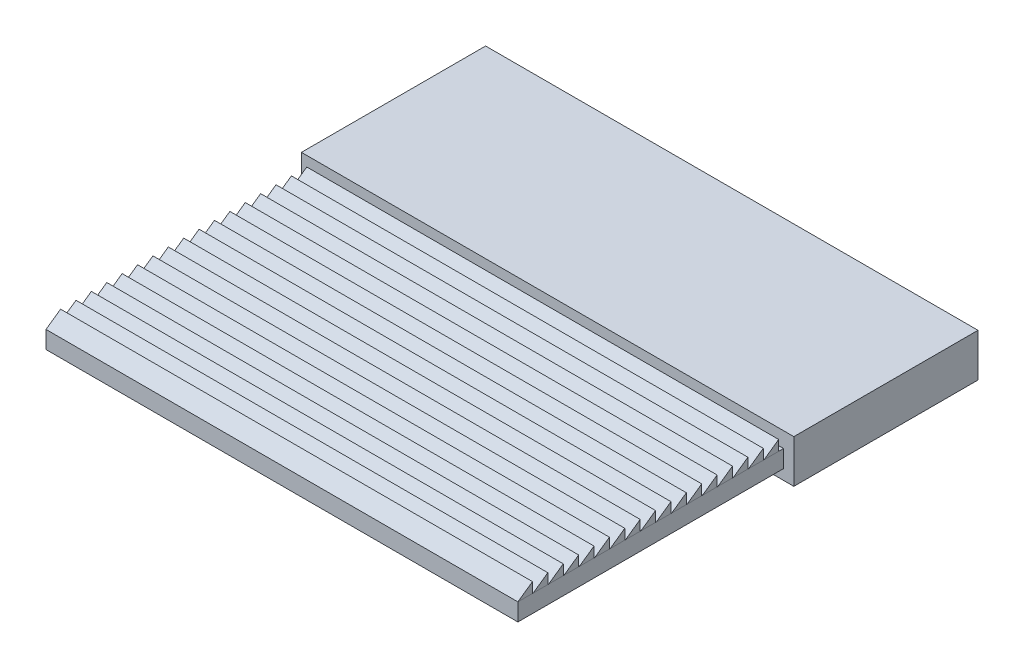
from build123d import *

# Parameters (mm, degrees)
SKETCH1_W              = 240
SKETCH1_H              = 351.15
BOSS_EXTRUDE3_DEPTH    = 21
SKETCH5_W              = 248.975913499
SKETCH5_H              = 113.170869772
CUT_EXTRUDE2_DEPTH     = 513
SKETCH4_W              = 240
SKETCH4_H              = 129.5
CUT_EXTRUDE3_DEPTH     = 7.5
SKETCH6_W              = 240
SKETCH6_H              = 129.5
CUT_EXTRUDE4_DEPTH     = 5
SKETCH8_W              = 129.5
SKETCH8_H              = 8.5
CUT_EXTRUDE6_DEPTH     = 5
SKETCH7_W              = 129.5
SKETCH7_H              = 8.5
CUT_EXTRUDE7_DEPTH     = 5
BOSS_EXTRUDE4_DEPTH    = 230
BOSS_EXTRUDE4_2_DEPTH  = 230
BOSS_EXTRUDE4_3_DEPTH  = 230
BOSS_EXTRUDE4_4_DEPTH  = 230
BOSS_EXTRUDE4_5_DEPTH  = 230
BOSS_EXTRUDE4_6_DEPTH  = 230
BOSS_EXTRUDE4_7_DEPTH  = 230
BOSS_EXTRUDE4_8_DEPTH  = 230
BOSS_EXTRUDE4_9_DEPTH  = 230
BOSS_EXTRUDE4_10_DEPTH = 230
BOSS_EXTRUDE4_11_DEPTH = 230
BOSS_EXTRUDE4_12_DEPTH = 230
BOSS_EXTRUDE4_13_DEPTH = 230
BOSS_EXTRUDE4_14_DEPTH = 230
BOSS_EXTRUDE4_15_DEPTH = 230
BOSS_EXTRUDE4_16_DEPTH = 230
BOSS_EXTRUDE4_17_DEPTH = 230


with BuildPart() as part:
    # Sketch1 → Boss-Extrude3 (new body)
    with BuildSketch(Plane(origin=(0, 0, 0), x_dir=(1, 0, 0), z_dir=(0, 1, 0))):
        with Locations((21.823446746, 98.176553254)):
            Rectangle(SKETCH1_W, SKETCH1_H)
    extrude(amount=BOSS_EXTRUDE3_DEPTH)

    # Sketch5 → Cut-Extrude2 (cut)
    with BuildSketch(Plane(origin=(0, 0, -54.481553254), x_dir=(-1, 0, 0), z_dir=(0, 0, -1))):
        with Locations((-20.8478358, 4.110963623)):
            Rectangle(SKETCH5_W, SKETCH5_H)
    extrude(amount=-CUT_EXTRUDE2_DEPTH, mode=Mode.SUBTRACT)

    # Sketch4 → Cut-Extrude3 (cut)
    with BuildSketch(Plane(origin=(0, 21, 0), x_dir=(1, 0, 0), z_dir=(0, 1, 0))):
        with Locations((21.823446746, 119.231553254)):
            Rectangle(SKETCH4_W, SKETCH4_H)
    extrude(amount=-CUT_EXTRUDE3_DEPTH, mode=Mode.SUBTRACT)

    # Sketch6 → Cut-Extrude4 (cut)
    with BuildSketch(Plane.XZ):
        with Locations((21.823446746, -119.231553254)):
            Rectangle(SKETCH6_W, SKETCH6_H)
    extrude(amount=-CUT_EXTRUDE4_DEPTH, mode=Mode.SUBTRACT)

    # Sketch8 → Cut-Extrude6 (cut)
    with BuildSketch(Plane.ZY.offset(98.176553254)):
        with Locations((-119.231553254, 9.25)):
            Rectangle(SKETCH8_W, SKETCH8_H)
    extrude(amount=-CUT_EXTRUDE6_DEPTH, mode=Mode.SUBTRACT)

    # Sketch7 → Cut-Extrude7 (cut)
    with BuildSketch(Plane(origin=(141.823446746, 0, 0), x_dir=(0, 0, -1), z_dir=(1, 0, 0))):
        with Locations((119.231553254, 9.25)):
            Rectangle(SKETCH7_W, SKETCH7_H)
    extrude(amount=-CUT_EXTRUDE7_DEPTH, mode=Mode.SUBTRACT)


with BuildPart() as body_2:
    # Sketch14 → Boss-Extrude4 (new body)
    with BuildSketch(Plane(origin=(136.823446746, 0, 0), x_dir=(0, 0, -1), z_dir=(1, 0, 0))):
        Polygon((61.596858709, 18.5), (54.481553254, 13.5), (61.596858709, 13.5), align=None)
    extrude(amount=-BOSS_EXTRUDE4_DEPTH)


with BuildPart() as body_3:
    # Sketch14 → Boss-Extrude4 2 (new body)
    with BuildSketch(Plane(origin=(136.823446746, 0, 0), x_dir=(0, 0, -1), z_dir=(1, 0, 0))):
        Polygon((69.096858709, 18.5), (61.981553254, 13.5), (69.096858709, 13.5), align=None)
    extrude(amount=-BOSS_EXTRUDE4_2_DEPTH)


with BuildPart() as body_4:
    # Sketch14 → Boss-Extrude4 3 (new body)
    with BuildSketch(Plane(origin=(136.823446746, 0, 0), x_dir=(0, 0, -1), z_dir=(1, 0, 0))):
        Polygon((76.596858709, 18.5), (69.481553254, 13.5), (76.596858709, 13.5), align=None)
    extrude(amount=-BOSS_EXTRUDE4_3_DEPTH)


with BuildPart() as body_5:
    # Sketch14 → Boss-Extrude4 4 (new body)
    with BuildSketch(Plane(origin=(136.823446746, 0, 0), x_dir=(0, 0, -1), z_dir=(1, 0, 0))):
        Polygon((84.096858709, 18.5), (76.981553254, 13.5), (84.096858709, 13.5), align=None)
    extrude(amount=-BOSS_EXTRUDE4_4_DEPTH)


with BuildPart() as body_6:
    # Sketch14 → Boss-Extrude4 5 (new body)
    with BuildSketch(Plane(origin=(136.823446746, 0, 0), x_dir=(0, 0, -1), z_dir=(1, 0, 0))):
        Polygon((91.596858709, 18.5), (84.481553254, 13.5), (91.596858709, 13.5), align=None)
    extrude(amount=-BOSS_EXTRUDE4_5_DEPTH)


with BuildPart() as body_7:
    # Sketch14 → Boss-Extrude4 6 (new body)
    with BuildSketch(Plane(origin=(136.823446746, 0, 0), x_dir=(0, 0, -1), z_dir=(1, 0, 0))):
        Polygon((99.096858709, 18.5), (91.981553254, 13.5), (99.096858709, 13.5), align=None)
    extrude(amount=-BOSS_EXTRUDE4_6_DEPTH)


with BuildPart() as body_8:
    # Sketch14 → Boss-Extrude4 7 (new body)
    with BuildSketch(Plane(origin=(136.823446746, 0, 0), x_dir=(0, 0, -1), z_dir=(1, 0, 0))):
        Polygon((106.596858709, 18.5), (99.481553254, 13.5), (106.596858709, 13.5), align=None)
    extrude(amount=-BOSS_EXTRUDE4_7_DEPTH)


with BuildPart() as body_9:
    # Sketch14 → Boss-Extrude4 8 (new body)
    with BuildSketch(Plane(origin=(136.823446746, 0, 0), x_dir=(0, 0, -1), z_dir=(1, 0, 0))):
        Polygon((114.096858709, 18.5), (106.981553254, 13.5), (114.096858709, 13.5), align=None)
    extrude(amount=-BOSS_EXTRUDE4_8_DEPTH)


with BuildPart() as body_10:
    # Sketch14 → Boss-Extrude4 9 (new body)
    with BuildSketch(Plane(origin=(136.823446746, 0, 0), x_dir=(0, 0, -1), z_dir=(1, 0, 0))):
        Polygon((121.596858709, 18.5), (114.481553254, 13.5), (121.596858709, 13.5), align=None)
    extrude(amount=-BOSS_EXTRUDE4_9_DEPTH)


with BuildPart() as body_11:
    # Sketch14 → Boss-Extrude4 10 (new body)
    with BuildSketch(Plane(origin=(136.823446746, 0, 0), x_dir=(0, 0, -1), z_dir=(1, 0, 0))):
        Polygon((129.096858709, 18.5), (121.981553254, 13.5), (129.096858709, 13.5), align=None)
    extrude(amount=-BOSS_EXTRUDE4_10_DEPTH)


with BuildPart() as body_12:
    # Sketch14 → Boss-Extrude4 11 (new body)
    with BuildSketch(Plane(origin=(136.823446746, 0, 0), x_dir=(0, 0, -1), z_dir=(1, 0, 0))):
        Polygon((136.596858709, 18.5), (129.481553254, 13.5), (136.596858709, 13.5), align=None)
    extrude(amount=-BOSS_EXTRUDE4_11_DEPTH)


with BuildPart() as body_13:
    # Sketch14 → Boss-Extrude4 12 (new body)
    with BuildSketch(Plane(origin=(136.823446746, 0, 0), x_dir=(0, 0, -1), z_dir=(1, 0, 0))):
        Polygon((144.096858709, 18.5), (136.981553254, 13.5), (144.096858709, 13.5), align=None)
    extrude(amount=-BOSS_EXTRUDE4_12_DEPTH)


with BuildPart() as body_14:
    # Sketch14 → Boss-Extrude4 13 (new body)
    with BuildSketch(Plane(origin=(136.823446746, 0, 0), x_dir=(0, 0, -1), z_dir=(1, 0, 0))):
        Polygon((151.596858709, 18.5), (144.481553254, 13.5), (151.596858709, 13.5), align=None)
    extrude(amount=-BOSS_EXTRUDE4_13_DEPTH)


with BuildPart() as body_15:
    # Sketch14 → Boss-Extrude4 14 (new body)
    with BuildSketch(Plane(origin=(136.823446746, 0, 0), x_dir=(0, 0, -1), z_dir=(1, 0, 0))):
        Polygon((159.096858709, 18.5), (151.981553254, 13.5), (159.096858709, 13.5), align=None)
    extrude(amount=-BOSS_EXTRUDE4_14_DEPTH)


with BuildPart() as body_16:
    # Sketch14 → Boss-Extrude4 15 (new body)
    with BuildSketch(Plane(origin=(136.823446746, 0, 0), x_dir=(0, 0, -1), z_dir=(1, 0, 0))):
        Polygon((166.596858709, 18.5), (159.481553254, 13.5), (166.596858709, 13.5), align=None)
    extrude(amount=-BOSS_EXTRUDE4_15_DEPTH)


with BuildPart() as body_17:
    # Sketch14 → Boss-Extrude4 16 (new body)
    with BuildSketch(Plane(origin=(136.823446746, 0, 0), x_dir=(0, 0, -1), z_dir=(1, 0, 0))):
        Polygon((174.096858709, 18.5), (166.981553254, 13.5), (174.096858709, 13.5), align=None)
    extrude(amount=-BOSS_EXTRUDE4_16_DEPTH)


with BuildPart() as body_18:
    # Sketch14 → Boss-Extrude4 17 (new body)
    with BuildSketch(Plane(origin=(136.823446746, 0, 0), x_dir=(0, 0, -1), z_dir=(1, 0, 0))):
        Polygon((181.596858709, 18.5), (174.481553254, 13.5), (181.596858709, 13.5), align=None)
    extrude(amount=-BOSS_EXTRUDE4_17_DEPTH)


solid = Compound([part.part, body_2.part, body_3.part, body_4.part, body_5.part, body_6.part, body_7.part, body_8.part, body_9.part, body_10.part, body_11.part, body_12.part, body_13.part, body_14.part, body_15.part, body_16.part, body_17.part, body_18.part])
